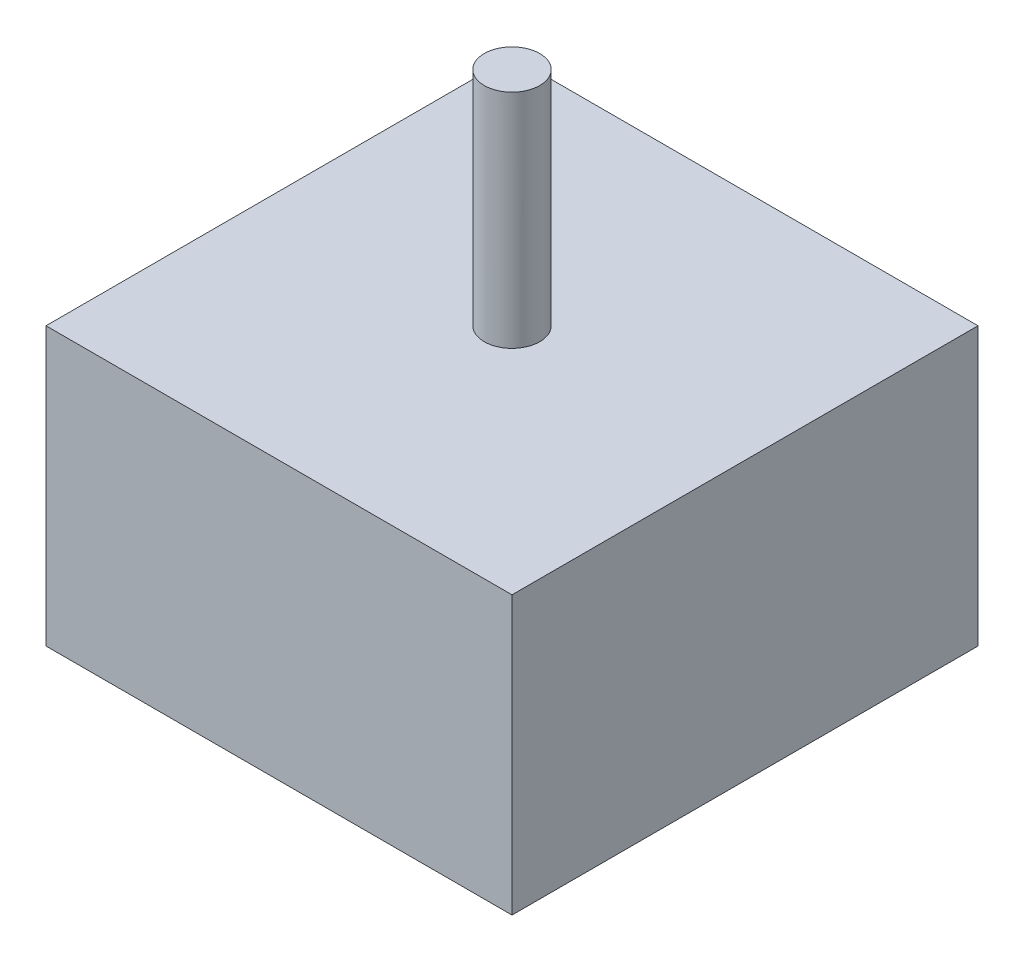
from build123d import *

# Parameters (mm, degrees)
SKETCH1_W           = 42
SKETCH1_H           = 42
BOSS_EXTRUDE1_DEPTH = 25
SKETCH2_R           = 2.5
BOSS_EXTRUDE2_DEPTH = 20


with BuildPart() as part:
    # Sketch1 → Boss-Extrude1 (new body)
    with BuildSketch(Plane(origin=(0, 0, 0), x_dir=(1, 0, 0), z_dir=(0, 1, 0))):
        Rectangle(SKETCH1_W, SKETCH1_H)
    extrude(amount=BOSS_EXTRUDE1_DEPTH)

    # Sketch2 → Boss-Extrude2 (add)
    with BuildSketch(Plane(origin=(0, 25, 0), x_dir=(1, 0, 0), z_dir=(0, 1, 0))):
        with Locations(Location((0, 0, 0), (0, 0, 90))):
            Circle(SKETCH2_R)
    extrude(amount=BOSS_EXTRUDE2_DEPTH)


solid = part.part
